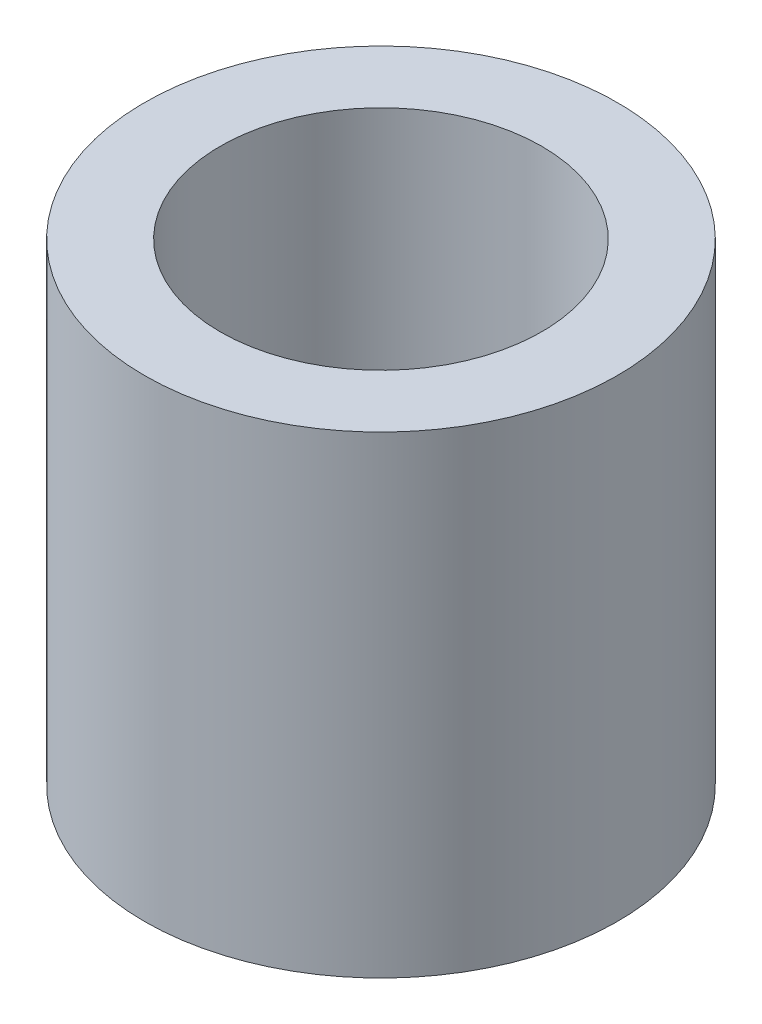
from build123d import *

# Parameters (mm, degrees)
SKETCH1_R           = 2.5
SKETCH1_R_2         = 1.7
BOSS_EXTRUDE1_DEPTH = 5


with BuildPart() as part:
    # Sketch1 → Boss-Extrude1 (new body)
    with BuildSketch(Plane(origin=(0, 0, 0), x_dir=(1, 0, 0), z_dir=(0, 1, 0))):
        with Locations(Location((0, 0, 0), (0, 0, 270))):
            Circle(SKETCH1_R)
        with Locations(Location((0, 0, 0), (0, 0, 270))):
            Circle(SKETCH1_R_2, mode=Mode.SUBTRACT)
    extrude(amount=BOSS_EXTRUDE1_DEPTH)


solid = part.part
